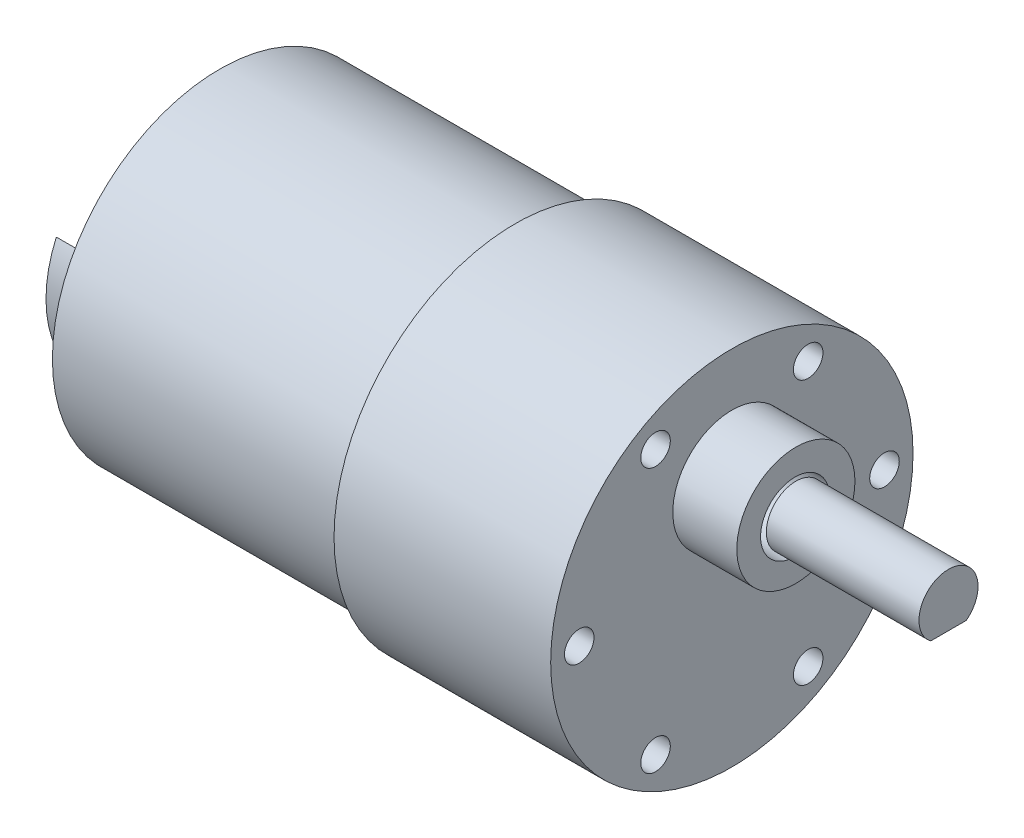
from build123d import *
from build123d.topology import SkipClean

# Parameters (mm, degrees)
ESQUISSE1_W                       = 22
ESQUISSE1_H                       = 18.4
ESQUISSE2_R                       = 17
BOSS_EXTRU_1_DEPTH                = 30
ESQUISSE3_R                       = 12.05
BOSS_EXTRU_2_DEPTH                = 5.6
ENL_V_START                       = -4.6
ENL_V_MAT_EXTRU_1_DEPTH           = 4.6
BOSS_EXTRU_3_DEPTH                = 4.6
ESQUISSE6_R                       = 6
BOSS_EXTRU_4_DEPTH                = 6.5
ESQUISSE7_R                       = 3
BOSS_EXTRU_5_DEPTH                = 15.5
ENL_V_START_2                     = -12
ENL_V_MAT_EXTRU_2_DEPTH           = 12
DIAM_TRE_DU_PER_AGE_3_0_3_1_D     = 3
DIAM_TRE_DU_PER_AGE_3_0_3_1_DEPTH = 4
ENL_V_START_3                     = -15.5
ESQUISSE12_R                      = 3.5
ENL_V_MAT_EXTRU_3_DEPTH           = 15


with BuildPart() as part:
    # Esquisse1 → Révolution1 (revolve)
    with BuildSketch(Plane.XY, mode=Mode.PRIVATE) as r_volution1_sk:
        with Locations((-11, 9.2)):
            Rectangle(ESQUISSE1_W, ESQUISSE1_H)
    revolve(r_volution1_sk.sketch.rotate(Axis((-22, 0, 0), (1, 0, 0)), 270), axis=Axis((-22, 0, 0), (1, 0, 0)))

    # Esquisse2 → Boss.-Extru.1 (add)
    with BuildSketch(Plane.ZY.offset(22)):
        Circle(ESQUISSE2_R)
    extrude(amount=BOSS_EXTRU_1_DEPTH)

    # Esquisse3 → Boss.-Extru.2 (add)
    with BuildSketch(Plane.ZY.offset(52)):
        Circle(ESQUISSE3_R)
    extrude(amount=BOSS_EXTRU_2_DEPTH)

    # Esquisse4 → Enlèv. mat.-Extru.1 (cut)
    with BuildSketch(Plane.ZY.offset(57.6).offset(ENL_V_START)):
        with BuildLine():
            Line((11, -4.919603643), (11, 4.919603643))
            ThreePointArc((11, 4.919603643), (-12.05, 0), (11, -4.919603643))
        make_face()
    extrude(amount=ENL_V_MAT_EXTRU_1_DEPTH, mode=Mode.SUBTRACT)

    # Esquisse5 → Boss.-Extru.3 (add)
    with SkipClean():  # the faces are left unmerged after this step: merging them gives an invalid solid
        with BuildSketch(Plane.ZY.offset(53)):
            with BuildLine():
                Line((-11, 4.919603643), (-11, -4.919603643))
                ThreePointArc((-11, -4.919603643), (-12.05, 0), (-11, 4.919603643))
            make_face()
        extrude(amount=BOSS_EXTRU_3_DEPTH)

    # Esquisse6 → Boss.-Extru.4 (add)
    with SkipClean():  # the faces are left unmerged after this step: merging them gives an invalid solid
        with BuildSketch(Plane(origin=(0, 0, 0), x_dir=(0, 0, -1), z_dir=(1, 0, 0))):
            with Locations((0, 7)):
                Circle(ESQUISSE6_R)
        extrude(amount=BOSS_EXTRU_4_DEPTH)

    # Esquisse7 → Boss.-Extru.5 (add)
    with SkipClean():  # the faces are left unmerged after this step: merging them gives an invalid solid
        with BuildSketch(Plane(origin=(6.5, 0, 0), x_dir=(0, 0, -1), z_dir=(1, 0, 0))):
            with Locations((0, 7)):
                Circle(ESQUISSE7_R)
        extrude(amount=BOSS_EXTRU_5_DEPTH)

    # Esquisse8 → Enlèv. mat.-Extru.2 (cut)
    with SkipClean():  # the faces are left unmerged after this step: merging them gives an invalid solid
        with BuildSketch(Plane(origin=(22, 0, 0), x_dir=(0, 0, -1), z_dir=(1, 0, 0)).offset(ENL_V_START_2)):
            with BuildLine():
                Line((1.8, 4.6), (-1.8, 4.6))
                ThreePointArc((-1.8, 4.6), (0, 4), (1.8, 4.6))
            make_face()
        extrude(amount=ENL_V_MAT_EXTRU_2_DEPTH, mode=Mode.SUBTRACT)

    # Diamètre du perçage Ø3.0 (3)1
    with Locations(Plane(origin=(0, 0, 0), x_dir=(0, 0, -1), z_dir=(1, 0, 0))):
        with Locations((15.5, 0), (-7.75, -13.423393759), (-7.75, 13.423393759), (7.75, -13.423393759), (7.75, 13.423393759), (-15.5, 0)):
            Hole(DIAM_TRE_DU_PER_AGE_3_0_3_1_D / 2, depth=DIAM_TRE_DU_PER_AGE_3_0_3_1_DEPTH)

    # Esquisse12 → Enlèv. mat.-Extru.3 (cut)
    with SkipClean():  # the faces are left unmerged after this step: merging them gives an invalid solid
        with BuildSketch(Plane(origin=(22, 0, 0), x_dir=(0, 0, -1), z_dir=(1, 0, 0)).offset(ENL_V_START_3)):
            with Locations((-0.08652583, 6.909100079)):
                Circle(ESQUISSE12_R)
        extrude(amount=-ENL_V_MAT_EXTRU_3_DEPTH, mode=Mode.SUBTRACT)


with BuildPart() as enl_v_mat_extru_3_piece_1:
    # of the separate pieces the step leaves, piece 1, a body of its own (enl_v_mat_extru_3_pieces)
    add(part.part.solids().sort_by_distance((-22, 0, -18.4))[0])


with BuildPart() as enl_v_mat_extru_3_piece_2:
    # of the separate pieces the step leaves, piece 2, a body of its own (enl_v_mat_extru_3_pieces)
    add(part.part.solids().sort_by_distance((6.5, 7, -3))[0])


solid = Compound([enl_v_mat_extru_3_piece_1.part, enl_v_mat_extru_3_piece_2.part])
